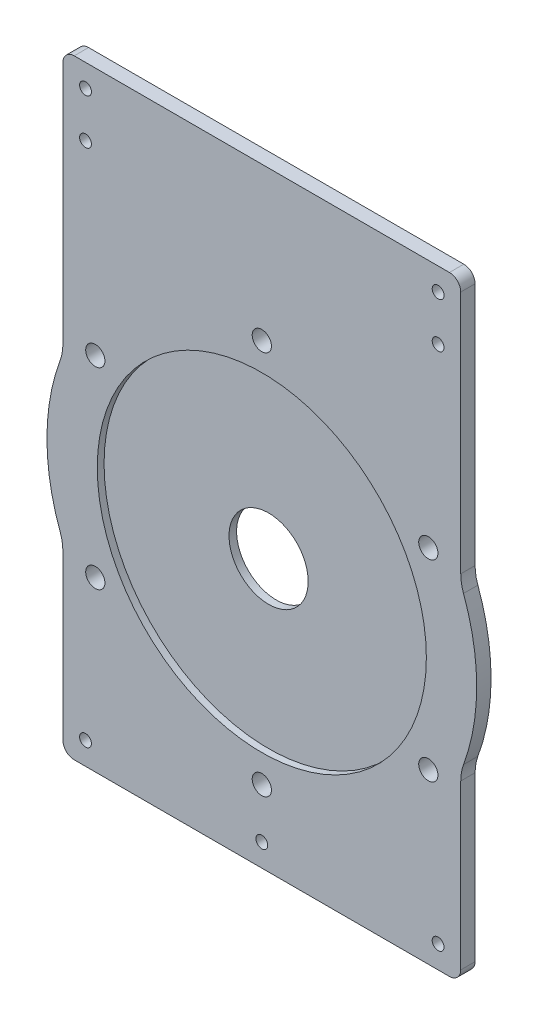
from build123d import *

# Parameters (mm, degrees)
SKETCH1_R                    = 95
BOSS_EXTRUDE1_DEPTH          = 6.35
BOSS_EXTRUDE2_START          = -6.35
BOSS_EXTRUDE2_DEPTH          = 6.35
SKETCH4_R                    = 72.75
CUT_EXTRUDE2_DEPTH           = 3
CUT_EXTRUDE3_REACH           = 152.749
SKETCH5_R                    = 17.5
TAP_DRILL_FOR_M10X1_5_TAP1_D = 8.5
CUT_EXTRUDE4_REACH           = 152.845
SKETCH3_R                    = 2.6162
BOSS_EXTRUDE3_START          = -6.35
BOSS_EXTRUDE3_DEPTH          = 6.35
CUT_EXTRUDE5_REACH           = 181.824
SKETCH9_R                    = 2.6162
FILLET1_R                    = 20
FILLET2_R                    = 5


with BuildPart() as part:
    # Sketch1 → Boss-Extrude1 (new body)
    with BuildSketch(Plane.XY):
        Circle(SKETCH1_R)
    extrude(amount=BOSS_EXTRUDE1_DEPTH)

    # Sketch2 → Boss-Extrude2 (add)
    with BuildSketch(Plane.XY.offset(6.35).offset(BOSS_EXTRUDE2_START)):
        with BuildLine():
            Line((87.946, -117), (-87.946, -117))
            Line((-87.946, -117), (-87.946, -35.923544981))
            ThreePointArc((-87.946, -35.923544981), (0, -95), (87.946, -35.923544981))
            Line((87.946, -35.923544981), (87.946, -117))
        make_face()
    extrude(amount=BOSS_EXTRUDE2_DEPTH)

    # Sketch4 → Cut-Extrude2 (cut)
    with BuildSketch(Plane.XY.offset(6.35)):
        Circle(SKETCH4_R)
    extrude(amount=-CUT_EXTRUDE2_DEPTH, mode=Mode.SUBTRACT)

    # Sketch5 → Cut-Extrude3 (cut, up to next)
    with BuildSketch(Plane.XY.offset(3.35), mode=Mode.PRIVATE) as cut_extrude3_sk1:
        Circle(SKETCH5_R)
    cut_extrude3_tool1 = extrude(cut_extrude3_sk1.sketch, amount=-CUT_EXTRUDE3_REACH, mode=Mode.PRIVATE) & part.part
    add(cut_extrude3_tool1.solids().sort_by_distance((0, 0, 3.35))[0], mode=Mode.SUBTRACT)

    # Tap Drill for M10x1.5 Tap1 (through all)
    with Locations(Plane(origin=(0, 85, 6.35), x_dir=(1, 0, 0), z_dir=(0, 0, 1))):
        with Locations((0, 0), (73.612159322, -42.5), (73.612159322, -127.5), (0, -170), (-73.612159322, -127.5), (-73.612159322, -42.5)):
            Hole(TAP_DRILL_FOR_M10X1_5_TAP1_D / 2)

    # Sketch3 → Cut-Extrude4 (cut, up to next)
    with BuildSketch(Plane.XY.offset(6.35), mode=Mode.PRIVATE) as cut_extrude4_sk1:
        with Locations((-77.946, -107)):
            Circle(SKETCH3_R)
    cut_extrude4_tool1 = extrude(cut_extrude4_sk1.sketch, amount=-CUT_EXTRUDE4_REACH, mode=Mode.PRIVATE) & part.part
    # Sketch3 → Cut-Extrude4 (cut, up to next)
    with BuildSketch(Plane.XY.offset(6.35), mode=Mode.PRIVATE) as cut_extrude4_sk2:
        with Locations((77.946, -107)):
            Circle(SKETCH3_R)
    cut_extrude4_tool2 = extrude(cut_extrude4_sk2.sketch, amount=-CUT_EXTRUDE4_REACH, mode=Mode.PRIVATE) & part.part
    # Sketch3 → Cut-Extrude4 (cut, up to next)
    with BuildSketch(Plane.XY.offset(6.35), mode=Mode.PRIVATE) as cut_extrude4_sk3:
        with Locations((0, -107)):
            Circle(SKETCH3_R)
    cut_extrude4_tool3 = extrude(cut_extrude4_sk3.sketch, amount=-CUT_EXTRUDE4_REACH, mode=Mode.PRIVATE) & part.part
    add(cut_extrude4_tool1.solids().sort_by_distance((-77.946, -107, 6.35))[0], mode=Mode.SUBTRACT)
    add(cut_extrude4_tool2.solids().sort_by_distance((77.946, -107, 6.35))[0], mode=Mode.SUBTRACT)
    add(cut_extrude4_tool3.solids().sort_by_distance((0, -107, 6.35))[0], mode=Mode.SUBTRACT)

    # Sketch8 → Boss-Extrude3 (add)
    with BuildSketch(Plane.XY.offset(6.35).offset(BOSS_EXTRUDE3_START)):
        with BuildLine():
            Line((87.946, 152.5499), (-87.946, 152.5499))
            Line((-87.946, 152.5499), (-87.946, 35.923544981))
            ThreePointArc((-87.946, 35.923544981), (0, 95), (87.946, 35.923544981))
            Line((87.946, 35.923544981), (87.946, 152.5499))
        make_face()
    extrude(amount=BOSS_EXTRUDE3_DEPTH)

    # Sketch9 → Cut-Extrude5 (cut, up to next)
    with BuildSketch(Plane.XY.offset(6.35), mode=Mode.PRIVATE) as cut_extrude5_sk1:
        with Locations((-77.946, 142.5499)):
            Circle(SKETCH9_R)
    cut_extrude5_tool1 = extrude(cut_extrude5_sk1.sketch, amount=-CUT_EXTRUDE5_REACH, mode=Mode.PRIVATE) & part.part
    # Sketch9 → Cut-Extrude5 (cut, up to next)
    with BuildSketch(Plane.XY.offset(6.35), mode=Mode.PRIVATE) as cut_extrude5_sk2:
        with Locations((-77.946, 122.5499)):
            Circle(SKETCH9_R)
    cut_extrude5_tool2 = extrude(cut_extrude5_sk2.sketch, amount=-CUT_EXTRUDE5_REACH, mode=Mode.PRIVATE) & part.part
    # Sketch9 → Cut-Extrude5 (cut, up to next)
    with BuildSketch(Plane.XY.offset(6.35), mode=Mode.PRIVATE) as cut_extrude5_sk3:
        with Locations((77.946, 122.5499)):
            Circle(SKETCH9_R)
    cut_extrude5_tool3 = extrude(cut_extrude5_sk3.sketch, amount=-CUT_EXTRUDE5_REACH, mode=Mode.PRIVATE) & part.part
    # Sketch9 → Cut-Extrude5 (cut, up to next)
    with BuildSketch(Plane.XY.offset(6.35), mode=Mode.PRIVATE) as cut_extrude5_sk4:
        with Locations((77.946, 142.5499)):
            Circle(SKETCH9_R)
    cut_extrude5_tool4 = extrude(cut_extrude5_sk4.sketch, amount=-CUT_EXTRUDE5_REACH, mode=Mode.PRIVATE) & part.part
    add(cut_extrude5_tool1.solids().sort_by_distance((-77.946, 142.5499, 6.35))[0], mode=Mode.SUBTRACT)
    add(cut_extrude5_tool2.solids().sort_by_distance((-77.946, 122.5499, 6.35))[0], mode=Mode.SUBTRACT)
    add(cut_extrude5_tool3.solids().sort_by_distance((77.946, 122.5499, 6.35))[0], mode=Mode.SUBTRACT)
    add(cut_extrude5_tool4.solids().sort_by_distance((77.946, 142.5499, 6.35))[0], mode=Mode.SUBTRACT)

    # Fillet1
    fillet1_edges = [part.edges().sort_by_distance(p)[0] for p in [
        (-87.946, -35.923544981, 3.175),
        (87.946, -35.923544981, 3.175),
        (-87.946, 35.923544981, 3.175),
        (87.946, 35.923544981, 3.175),
    ]]
    fillet(fillet1_edges, radius=FILLET1_R)

    # Fillet2
    fillet2_edges = [part.edges().sort_by_distance(p)[0] for p in [
        (-87.946, -117, 3.175),
        (87.946, -117, 3.175),
        (-87.946, 152.5499, 3.175),
        (87.946, 152.5499, 3.175),
    ]]
    fillet(fillet2_edges, radius=FILLET2_R)


solid = part.part
